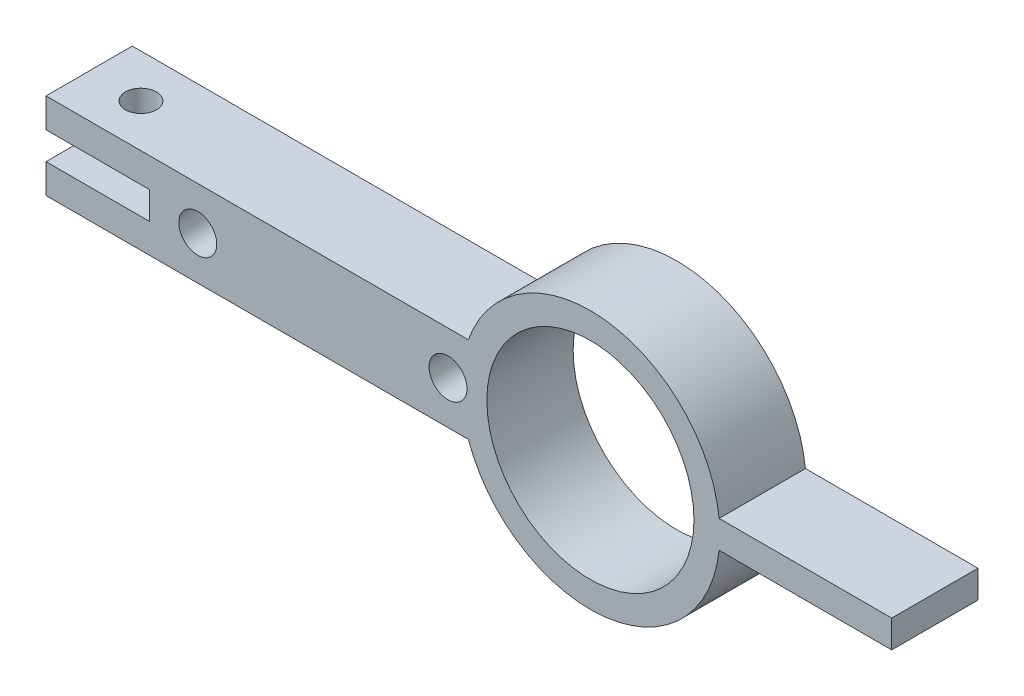
from build123d import *

# Parameters (mm, degrees)
BOSS_EXTRUDE1_DEPTH          = 2.5
TAP_DRILL_FOR_M12X1_5_TAP1_D = 12
HOLE1_D                      = 1.8
SKETCH7_R                    = 1.1
CUT_EXTRUDE1_DEPTH           = 33.805449556


with BuildPart() as part:
    # Sketch1 → Boss-Extrude1 (new, symmetric)
    with BuildSketch(Plane.XY):
        with BuildLine():
            Line((-31.542788725, 2.5), (-7.071067812, 2.5))
            ThreePointArc((-7.071067812, 2.5), (0.871651704, 7.449176015), (7.457211275, 0.8))
            Line((7.457211275, 0.8), (17.457211275, 0.8))
            Line((17.457211275, 0.8), (17.457211275, -0.8))
            Line((17.457211275, -0.8), (7.457211275, -0.8))
            ThreePointArc((7.457211275, -0.8), (0.871651704, -7.449176015), (-7.071067812, -2.5))
            Line((-7.071067812, -2.5), (-31.542788725, -2.5))
            Line((-31.542788725, -2.5), (-31.542788725, -0.8))
            Line((-31.542788725, -0.8), (-25.542788725, -0.8))
            Line((-25.542788725, -0.8), (-25.542788725, 0.8))
            Line((-25.542788725, 0.8), (-31.542788725, 0.8))
            Line((-31.542788725, 0.8), (-31.542788725, 2.5))
        make_face()
    extrude(amount=BOSS_EXTRUDE1_DEPTH, both=True)

    # Tap Drill for M12x1.5 Tap1 (through all)
    with Locations(Plane.XY.offset(2.5)):
        with Locations((0, 0)):
            Hole(TAP_DRILL_FOR_M12X1_5_TAP1_D / 2)

    # Hole1 (through all)
    with Locations(Plane(origin=(0, 2.5, 0), x_dir=(1, 0, 0), z_dir=(0, 1, 0))):
        with Locations((-28.542788725, 0)):
            Hole(HOLE1_D / 2)

    # Sketch7 → Cut-Extrude1 (cut, through all)
    with BuildSketch(Plane.XY.offset(-2.5)):
        with Locations((-8.25, 0)):
            Circle(SKETCH7_R)
        with Locations((-22.75, 0)):
            Circle(SKETCH7_R)
    extrude(amount=CUT_EXTRUDE1_DEPTH, mode=Mode.SUBTRACT)


solid = part.part
